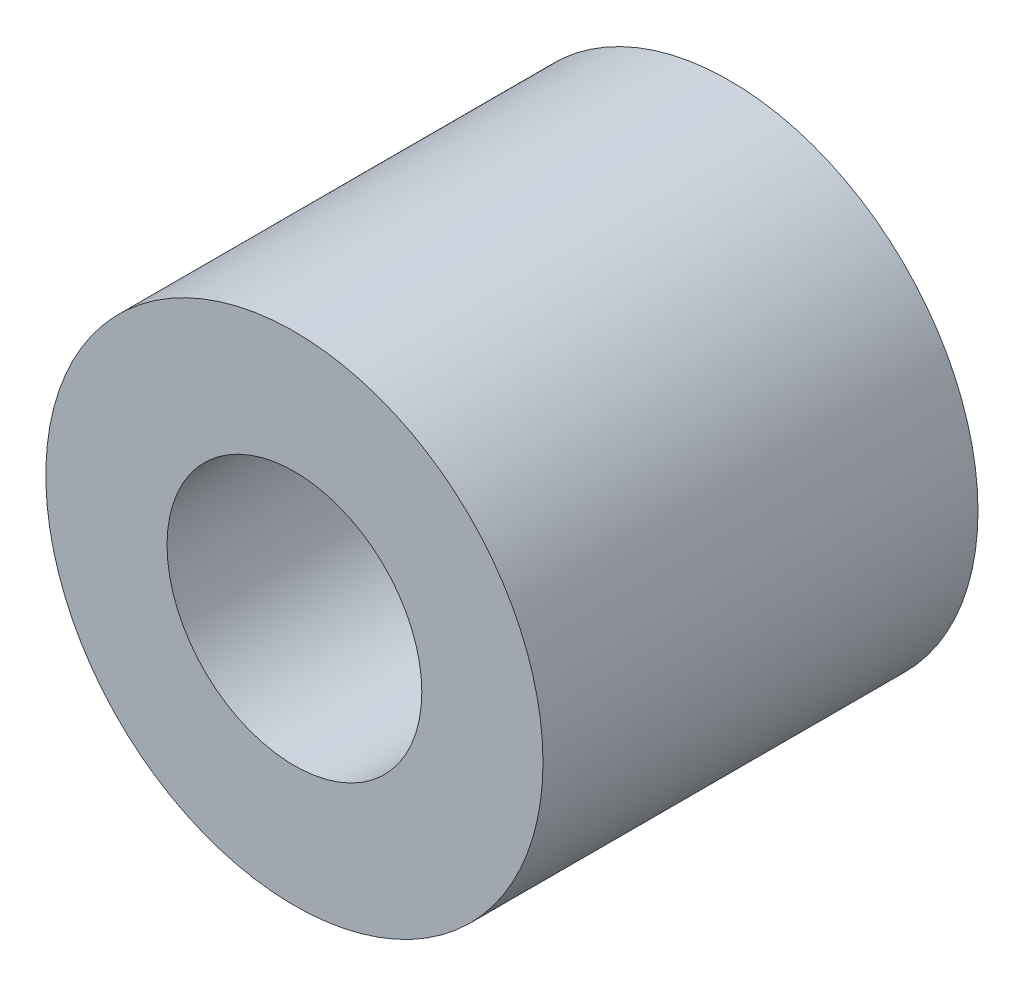
from build123d import *

# Parameters (mm, degrees)
SKETCH1_R           = 4
SKETCH1_R_2         = 2.05
BOSS_EXTRUDE1_DEPTH = 7


with BuildPart() as part:
    # Sketch1 → Boss-Extrude1 (new body)
    with BuildSketch(Plane.XY):
        Circle(SKETCH1_R)
        Circle(SKETCH1_R_2, mode=Mode.SUBTRACT)
    extrude(amount=BOSS_EXTRUDE1_DEPTH)


solid = part.part
